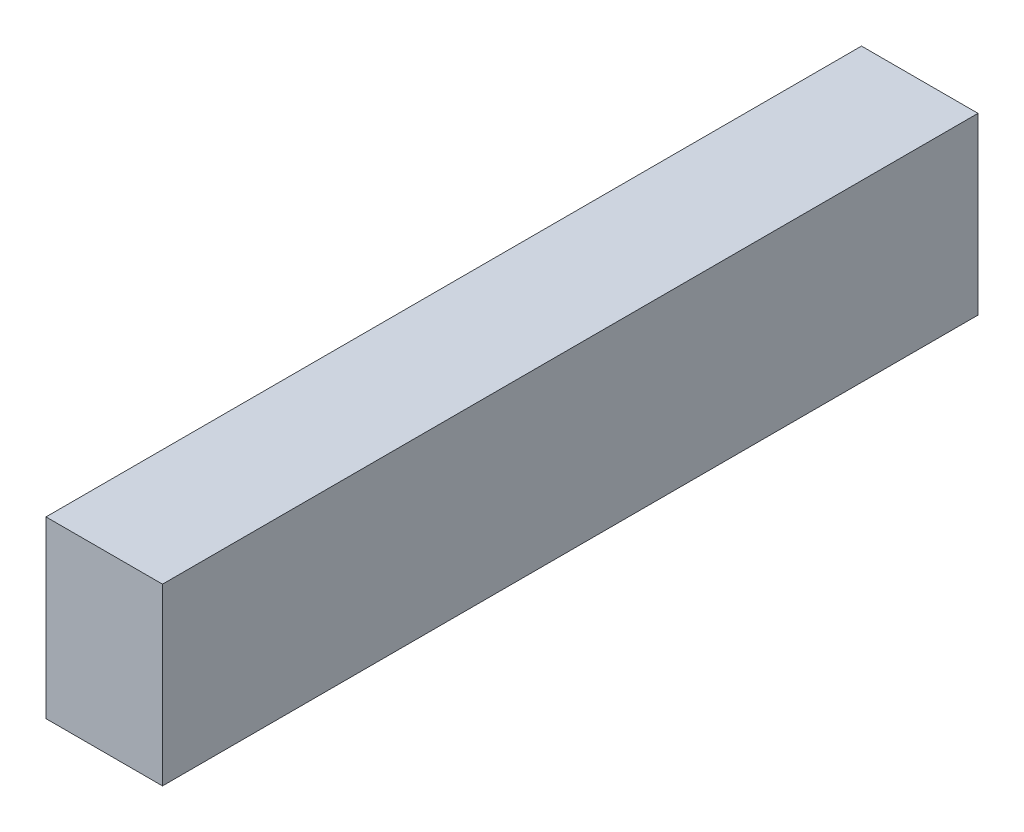
from build123d import *

# Parameters (mm, degrees)
PRESS_UC_PENCE_PARMAK_1_1_START = -160
SKETCH1_W                       = 20
SKETCH1_H                       = 30
PRESS_UC_PENCE_PARMAK_1_1_DEPTH = 140


with BuildPart() as part:
    # Sketch1 → PRESS_uc_pence_parmak_1_1 (new body)
    with BuildSketch(Plane.XY.offset(PRESS_UC_PENCE_PARMAK_1_1_START)):
        with Locations((80, 1269)):
            Rectangle(SKETCH1_W, SKETCH1_H)
    extrude(amount=-PRESS_UC_PENCE_PARMAK_1_1_DEPTH)


solid = part.part
